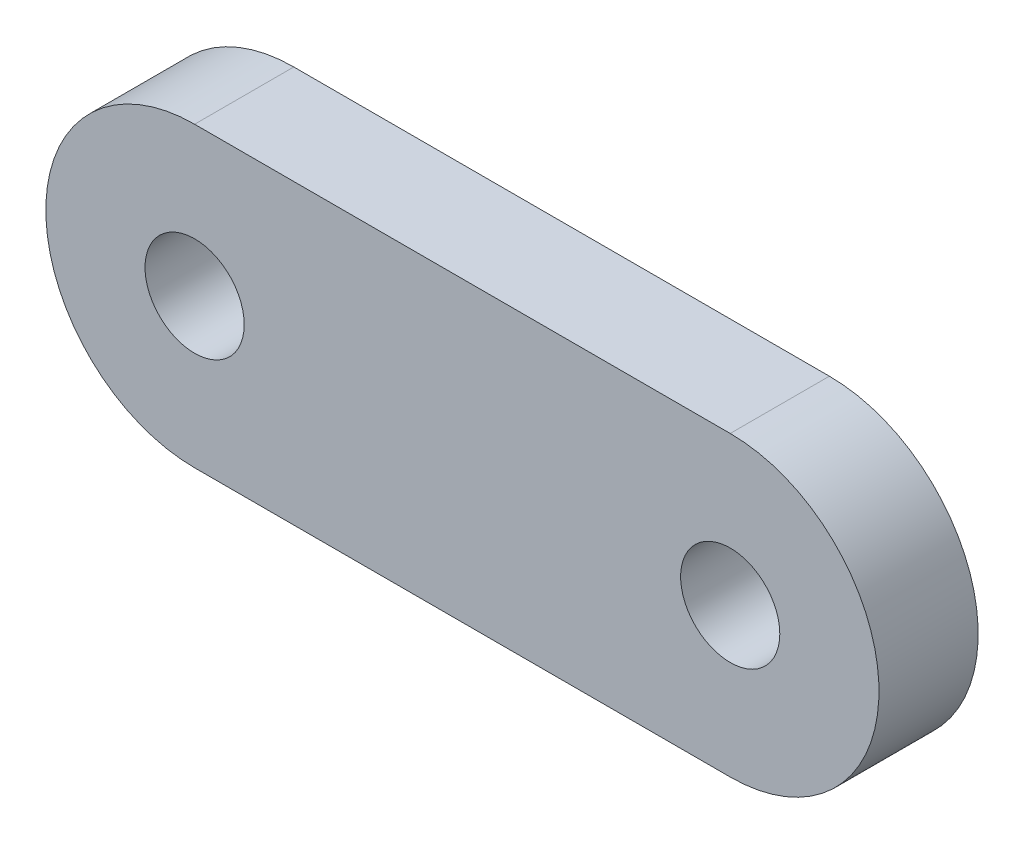
from build123d import *

# Parameters (mm, degrees)
CROQUIS3_R              = 1
SALIENTE_EXTRUIR1_DEPTH = 2


with BuildPart() as part:
    # Croquis3 → Saliente-Extruir1 (new body)
    with BuildSketch(Plane.XY):
        with BuildLine():
            Line((0, 3), (10.8, 3))
            ThreePointArc((10.8, 3), (13.8, 0), (10.8, -3))
            Line((10.8, -3), (0, -3))
            ThreePointArc((0, -3), (-3, 0), (0, 3))
        make_face()
        Circle(CROQUIS3_R, mode=Mode.SUBTRACT)
        with Locations((10.8, 0)):
            Circle(CROQUIS3_R, mode=Mode.SUBTRACT)
    extrude(amount=SALIENTE_EXTRUIR1_DEPTH)


solid = part.part
